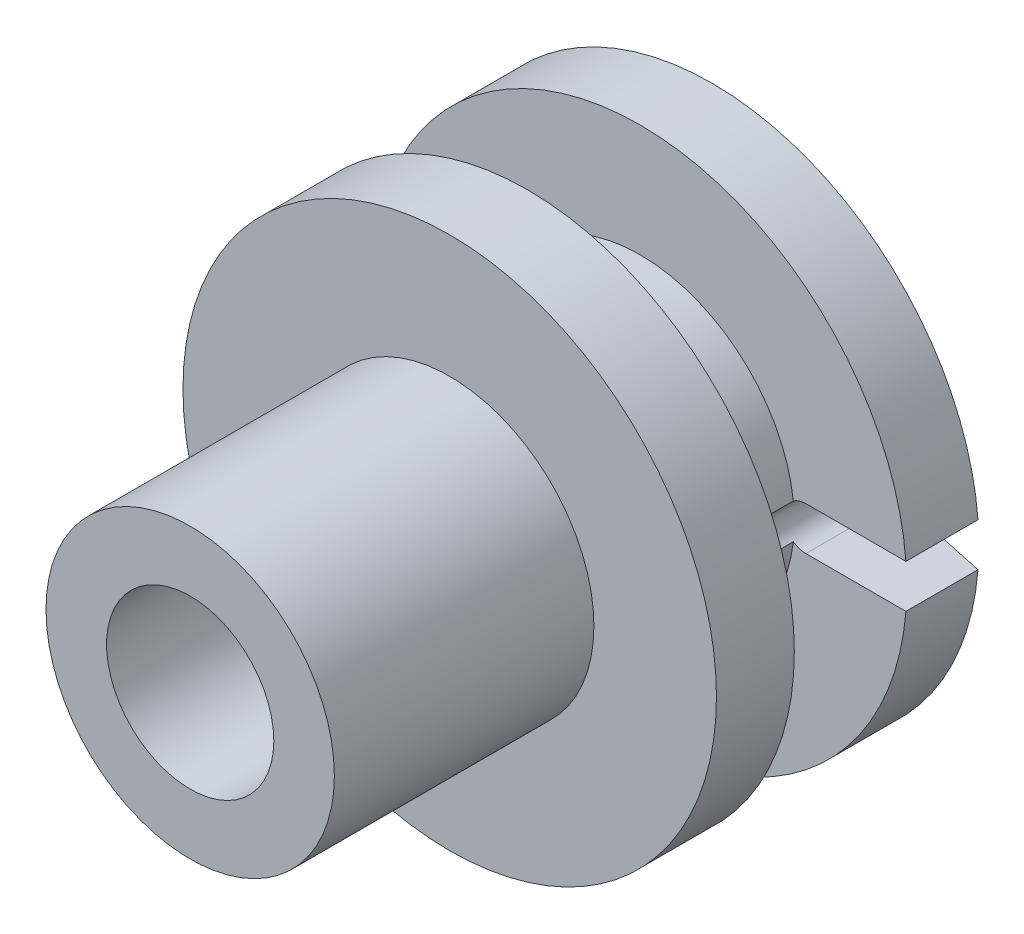
from build123d import *

# Parameters (mm, degrees)
SKETCH1_R           = 9.25
BOSS_EXTRUDE1_DEPTH = 2.5
SKETCH2_R           = 5.35
BOSS_EXTRUDE2_DEPTH = 3.9
SKETCH3_R           = 9.25
BOSS_EXTRUDE3_DEPTH = 2.7
SKETCH4_R           = 5
BOSS_EXTRUDE4_DEPTH = 9
CUT_EXTRUDE1_DEPTH  = 4.5
SKETCH8_R           = 2.9
CUT_EXTRUDE2_DEPTH  = 12


with BuildPart() as part:
    # Sketch1 → Boss-Extrude1 (new body)
    with BuildSketch(Plane.XY):
        Circle(SKETCH1_R)
    extrude(amount=BOSS_EXTRUDE1_DEPTH)

    # Sketch2 → Boss-Extrude2 (add)
    with BuildSketch(Plane.XY.offset(2.5)):
        Circle(SKETCH2_R)
    extrude(amount=BOSS_EXTRUDE2_DEPTH)

    # Sketch3 → Boss-Extrude3 (add)
    with BuildSketch(Plane.XY.offset(6.4)):
        Circle(SKETCH3_R)
    extrude(amount=BOSS_EXTRUDE3_DEPTH)

    # Sketch4 → Boss-Extrude4 (add)
    with BuildSketch(Plane.XY.offset(9.1)):
        Circle(SKETCH4_R)
    extrude(amount=BOSS_EXTRUDE4_DEPTH)

    # Sketch6 → Revolve1 (revolve)
    with BuildSketch(Plane(origin=(0, 0, 0), x_dir=(1, 0, 0), z_dir=(0, 1, 0)), mode=Mode.PRIVATE) as revolve1_sk:
        Polygon((0, 0), (0, 2), (9.25, 0), align=None)
    revolve(revolve1_sk.sketch.rotate(Axis((0, 0, 0), (0, 0, -1)), 180), axis=Axis((0, 0, 0), (0, 0, -1)))

    # Sketch7 → Cut-Extrude1 (cut, symmetric)
    with BuildSketch(Plane.XY):
        with BuildLine():
            Line((-5.75, 0.75), (-9.219544457, 0.75))
            ThreePointArc((-9.219544457, 0.75), (-9.25, 0), (-9.219544457, -0.75))
            Line((-9.219544457, -0.75), (-5.75, -0.75))
            ThreePointArc((-5.75, -0.75), (-5, 0), (-5.75, 0.75))
        make_face()
        with BuildLine():
            Line((5.75, -0.75), (9.219544457, -0.75))
            ThreePointArc((9.219544457, -0.75), (9.25, 0), (9.219544457, 0.75))
            Line((9.219544457, 0.75), (5.75, 0.75))
            ThreePointArc((5.75, 0.75), (5, 0), (5.75, -0.75))
        make_face()
    extrude(amount=CUT_EXTRUDE1_DEPTH, both=True, mode=Mode.SUBTRACT)

    # Sketch8 → Cut-Extrude2 (cut)
    with BuildSketch(Plane.XY.offset(18.1)):
        Circle(SKETCH8_R)
    extrude(amount=-CUT_EXTRUDE2_DEPTH, mode=Mode.SUBTRACT)


solid = part.part
